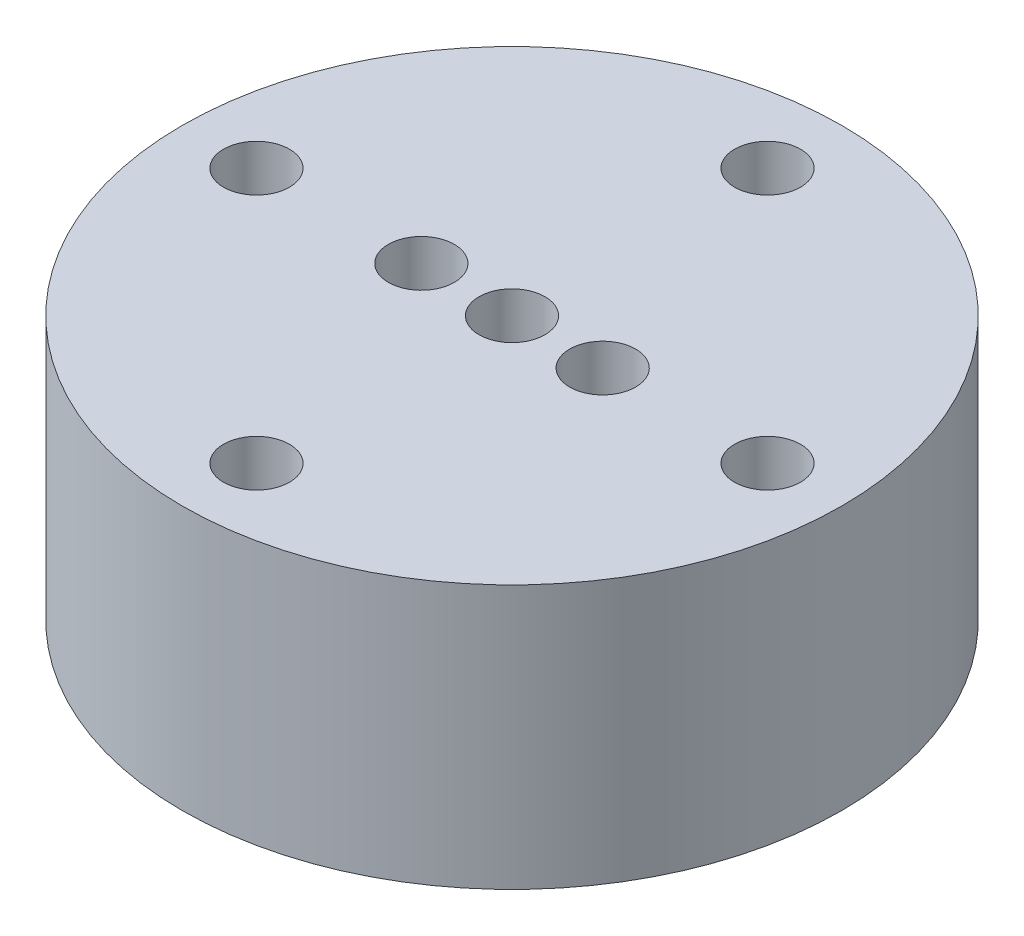
from build123d import *

# Parameters (mm, degrees)
SKETCH1_R           = 20
SKETCH1_R_2         = 2
BOSS_EXTRUDE1_DEPTH = 16
SKETCH2_R           = 2
CUT_EXTRUDE1_DEPTH  = 33.496153619


with BuildPart() as part:
    # Sketch1 → Boss-Extrude1 (new body)
    with BuildSketch(Plane(origin=(0, 0, 0), x_dir=(1, 0, 0), z_dir=(0, 1, 0))):
        with Locations(Location((0, 0, 0), (0, 0, 270))):
            Circle(SKETCH1_R)
        with Locations(Location((0, 15.5, 0), (0, 0, 270))):
            Circle(SKETCH1_R_2, mode=Mode.SUBTRACT)
        with Locations(Location((15.5, 0, 0), (0, 0, 270))):
            Circle(SKETCH1_R_2, mode=Mode.SUBTRACT)
        with Locations(Location((0, -15.5, 0), (0, 0, 270))):
            Circle(SKETCH1_R_2, mode=Mode.SUBTRACT)
        with Locations(Location((-15.5, 0, 0), (0, 0, 270))):
            Circle(SKETCH1_R_2, mode=Mode.SUBTRACT)
    extrude(amount=BOSS_EXTRUDE1_DEPTH)

    # Sketch2 → Cut-Extrude1 (cut, through all)
    with BuildSketch(Plane(origin=(0, 16, 0), x_dir=(1, 0, 0), z_dir=(0, 1, 0))):
        with Locations(Location((0, 0, 0), (0, 0, 270))):
            Circle(SKETCH2_R)
        with Locations(Location((5.5, 0, 0), (0, 0, 270))):
            Circle(SKETCH2_R)
        with Locations(Location((-5.5, 0, 0), (0, 0, 270))):
            Circle(SKETCH2_R)
    extrude(amount=-CUT_EXTRUDE1_DEPTH, mode=Mode.SUBTRACT)


solid = part.part
